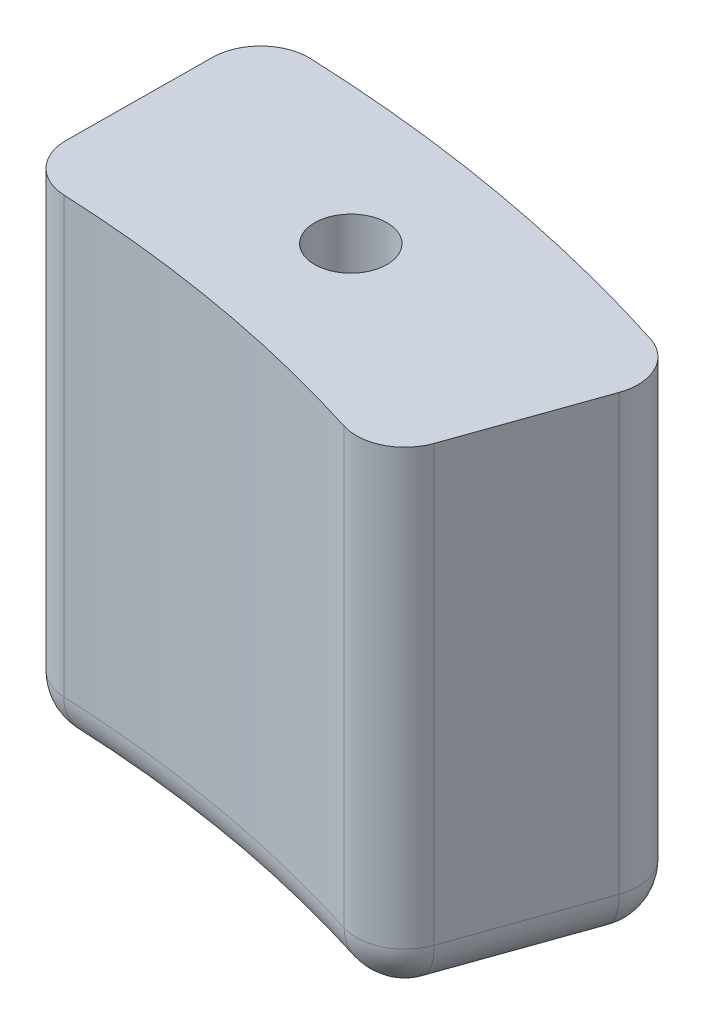
from build123d import *

# Parameters (mm, degrees)
EXTRUDE_1_DEPTH     = 20
FILLET_1_R          = 2
SKETCH_2_R          = 1.5
CUT_EXTRUDE_1_DEPTH = 10


with BuildPart() as part:
    # 草图1 → 凸台-拉伸1 (new body)
    with BuildSketch(Plane(origin=(0, 0, 0), x_dir=(1, 0, 0), z_dir=(0, 1, 0))):
        with BuildLine():
            Line((0.585585586, 64.997362174), (0.495495495, 54.997767993))
            ThreePointArc((0.495495495, 54.997767993), (9.550649772, 54.164426416), (18.344731031, 51.850466183))
            Line((18.344731031, 51.850466183), (21.680136673, 61.277823671))
            ThreePointArc((21.680136673, 61.277823671), (11.287131548, 64.012503946), (0.585585586, 64.997362174))
        make_face()
    extrude(amount=EXTRUDE_1_DEPTH)

    # 圆角1
    fillet_1_edges = [part.edges().sort_by_distance(p)[0] for p in [
        (9.550649772, 0, -54.164426416),
        (0.540540541, 0, -59.997565083),
        (11.287131548, 0, -64.012503946),
        (20.012433852, 0, -56.564144927),
        (18.344731031, 10, -51.850466183),
        (0.495495495, 10, -54.997767993),
        (0.585585586, 10, -64.997362174),
        (21.680136673, 10, -61.277823671),
    ]]
    fillet(fillet_1_edges, radius=FILLET_1_R)

    # 草图2 → 切除-拉伸1 (cut)
    with BuildSketch(Plane(origin=(0, 20, 0), x_dir=(1, 0, 0), z_dir=(0, 1, 0))):
        with Locations(Location((10.111516208, 59.141840012, 0), (0, 0, 270))):
            Circle(SKETCH_2_R)
    extrude(amount=-CUT_EXTRUDE_1_DEPTH, mode=Mode.SUBTRACT)


solid = part.part
